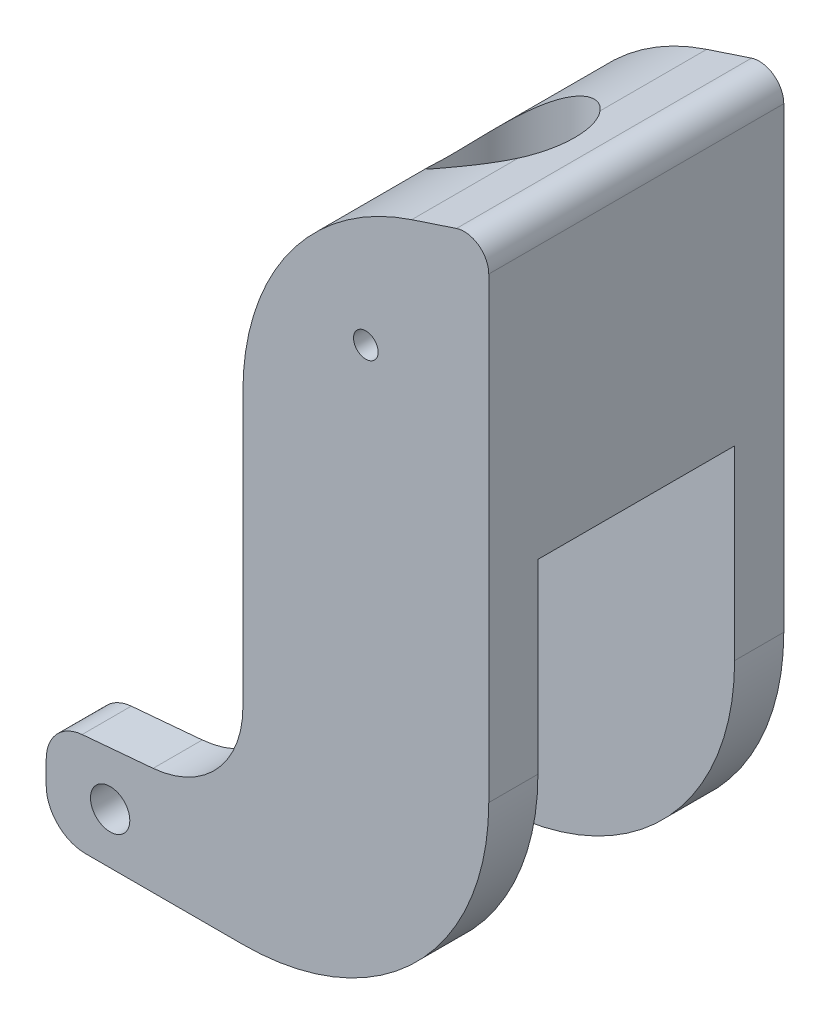
from build123d import *

# Parameters (mm, degrees)
SKETCH1_R               = 4
BOSS_EXTRUDE1_DEPTH     = 60
CUT_EXTRUDE1_DEPTH      = 148.042397089
CUT_EXTRUDE1_DEPTH_BACK = 148.042397089
SKETCH2_W               = 40
SKETCH2_H               = 100
CUT_EXTRUDE2_DEPTH      = 148.042397089
CUT_EXTRUDE2_DEPTH_BACK = 148.042397089
SKETCH4_R               = 12.5
CUT_EXTRUDE3_DEPTH      = 148.04239713
CUT_EXTRUDE3_DEPTH_BACK = 148.04239713
SKETCH5_R               = 2.5


with BuildPart() as part:
    # Sketch1 → Boss-Extrude1 (new body)
    with BuildSketch(Plane.XY):
        with BuildLine():
            Line((0, 18.32662348), (0, 73.848150904))
            ThreePointArc((0, 73.848150904), (9.481713685, 103.144370354), (34.330738963, 121.329455209))
            Line((34.330738963, 121.329455209), (43.433073896, 124.333308288))
            ThreePointArc((43.433073896, 124.333308288), (47.929621945, 123.637006489), (50, 119.585177858))
            Line((50, 119.585177858), (50, 26.500453459))
            ThreePointArc((50, 26.500453459), (35.355339059, -8.8548856), (0, -23.499546541))
            Line((0, -23.499546541), (-32, -23.499546541))
            ThreePointArc((-32, -23.499546541), (-37.656854249, -21.156400791), (-40, -15.499546541))
            Line((-40, -15.499546541), (-40, -10.830195933))
            ThreePointArc((-40, -10.830195933), (-37.898218694, -5.425474272), (-32.697245942, -2.860638348))
            Line((-32.697245942, -2.860638348), (-18.256885145, -1.597270481))
            ThreePointArc((-18.256885145, -1.597270481), (-5.254453264, 4.814819328), (0, 18.32662348))
        make_face()
        with Locations((-27, -13.164871237)):
            Circle(SKETCH1_R, mode=Mode.SUBTRACT)
    extrude(amount=BOSS_EXTRUDE1_DEPTH)

    # Sketch2 → Cut-Extrude1 (cut, two sides: drawn at the far end of the back side and taken through both)
    with BuildSketch(Plane(origin=(0, 0, 0), x_dir=(0, 0, -1), z_dir=(1, 0, 0)).offset(-CUT_EXTRUDE1_DEPTH_BACK)):
        with Locations((-30, 14.333308288)):
            Rectangle(SKETCH2_W, SKETCH2_H)
    extrude(amount=CUT_EXTRUDE1_DEPTH + CUT_EXTRUDE1_DEPTH_BACK, mode=Mode.SUBTRACT)

    # Sketch4 → Cut-Extrude2 (cut, two sides: drawn at the far end of the back side and taken through both)
    with BuildSketch(Plane(origin=(0, 0, 0), x_dir=(1, 0, 0), z_dir=(0, 1, 0)).offset(-CUT_EXTRUDE2_DEPTH_BACK)):
        with Locations(Location((25, -30, 0), (0, 0, 270))):
            Circle(SKETCH4_R)
    extrude(amount=CUT_EXTRUDE2_DEPTH + CUT_EXTRUDE2_DEPTH_BACK, mode=Mode.SUBTRACT)

    # Sketch5 → Cut-Extrude3 (cut, two sides: drawn at the far end of the back side and taken through both)
    with BuildSketch(Plane.XY.offset(60).offset(-CUT_EXTRUDE3_DEPTH_BACK)):
        with Locations((25, 94.585177858)):
            Circle(SKETCH5_R)
    extrude(amount=CUT_EXTRUDE3_DEPTH + CUT_EXTRUDE3_DEPTH_BACK, mode=Mode.SUBTRACT)


solid = part.part
